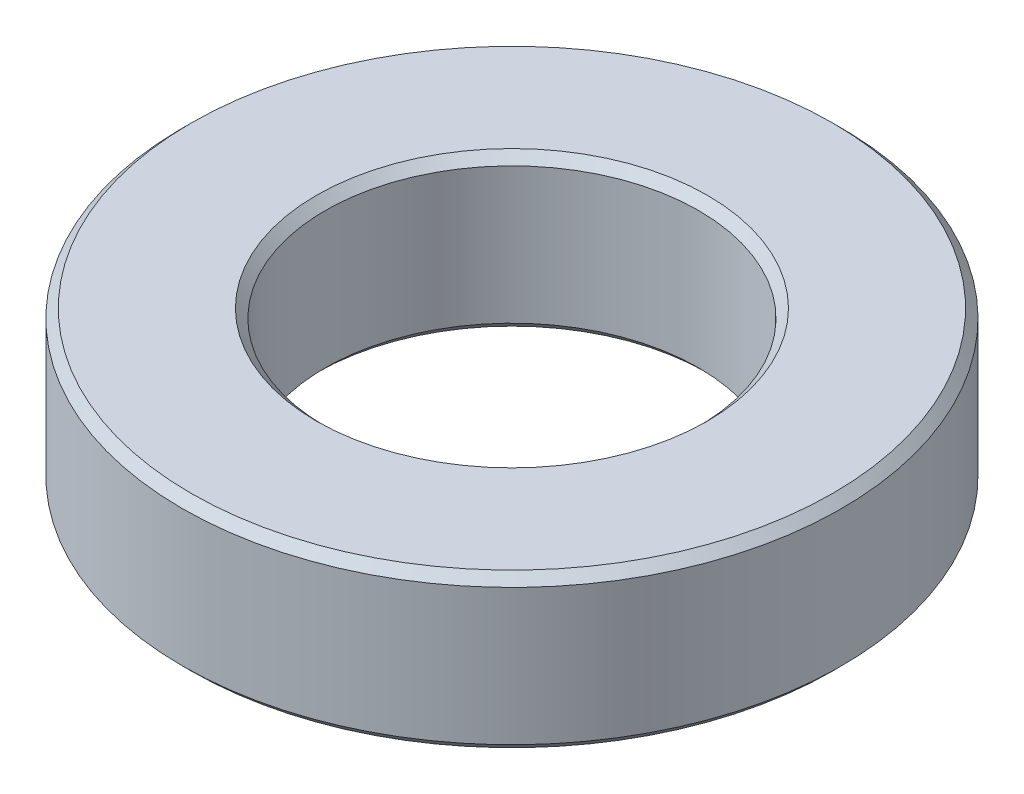
from build123d import *

# Parameters (mm, degrees)
SKETCH1_R           = 15
SKETCH1_R_2         = 8.5
BOSS_EXTRUDE1_DEPTH = 7
CHAMFER1_SIZE       = 0.4


with BuildPart() as part:
    # Sketch1 → Boss-Extrude1 (new body)
    with BuildSketch(Plane(origin=(0, 0, 0), x_dir=(1, 0, 0), z_dir=(0, 1, 0))):
        with Locations(Location((0, 0, 0), (0, 0, 270))):
            Circle(SKETCH1_R)
        with Locations(Location((0, 0, 0), (0, 0, 270))):
            Circle(SKETCH1_R_2, mode=Mode.SUBTRACT)
    extrude(amount=BOSS_EXTRUDE1_DEPTH)

    # Chamfer1
    chamfer1_edges = [part.edges().sort_by_distance(p)[0] for p in [
        (0, 0, -15),
        (0, 7, -15),
        (0, 0, -8.5),
        (0, 7, -8.5),
    ]]
    chamfer(chamfer1_edges, length=CHAMFER1_SIZE)


solid = part.part
